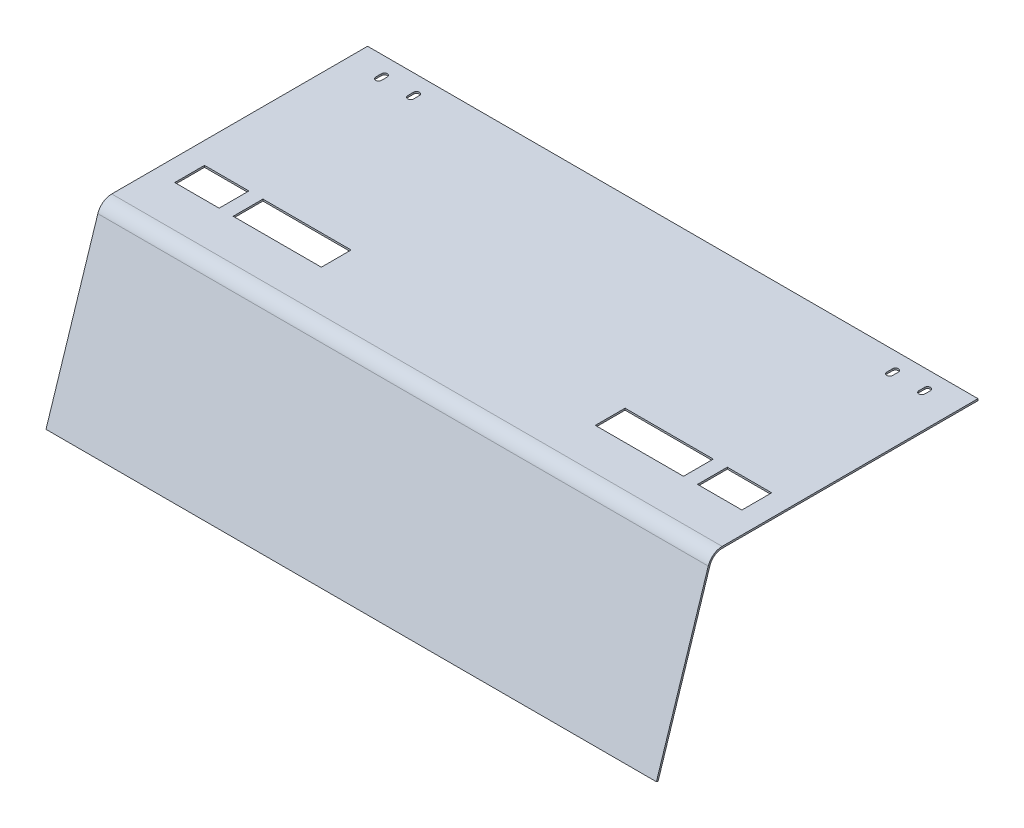
from build123d import *

# Parameters (mm, degrees)
SKETCH_1_W           = 418
SKETCH_1_H           = 175.21
EXTRUDE_1_DEPTH      = 1.2
EXTRUDE_2_DEPTH      = 209
EXTRUDE_2_DEPTH_BACK = 209
SKETCH_3_R           = 2
CUT_EXTRUDE_1_DEPTH  = 1.2
CUT_EXTRUDE_2_REACH  = 281.994
SKETCH_4_R           = 3
CUT_EXTRUDE_3_REACH  = 276.225
SKETCH_7_W           = 30.4
SKETCH_7_H           = 20.4
SKETCH_7_W_2         = 60.4


with BuildPart() as part:
    # 스케치1 → 보스-돌출1 (new body)
    with BuildSketch(Plane(origin=(0, 0, 0), x_dir=(1, 0, 0), z_dir=(0, 1, 0))):
        with Locations((0, -0.5)):
            Rectangle(SKETCH_1_W, SKETCH_1_H)
    extrude(amount=EXTRUDE_1_DEPTH)

    # 스케치2 → 보스-돌출2 (add, two sides: drawn at the far end of the back side and taken through both)
    with BuildSketch(Plane(origin=(0, 0, 0), x_dir=(0, 0, -1), z_dir=(1, 0, 0)).offset(-EXTRUDE_2_DEPTH_BACK)):
        with BuildLine():
            Line((-97.623087474, -5.733077953), (-133.119643249, -115.895422372))
            Line((-133.119643249, -115.895422372), (-131.977472753, -116.263453018))
            Line((-131.977472753, -116.263453018), (-96.480916977, -6.101108598))
            ThreePointArc((-96.480916977, -6.101108598), (-93.286204284, -1.686975175), (-88.105, 0))
            Line((-88.105, 0), (-88.105, 1.2))
            ThreePointArc((-88.105, 1.2), (-93.992732141, -0.717017244), (-97.623087474, -5.733077953))
        make_face()
    extrude(amount=EXTRUDE_2_DEPTH + EXTRUDE_2_DEPTH_BACK)

    # 스케치3 → 컷-돌출1 (cut)
    with BuildSketch(Plane(origin=(0, 1.2, 0), x_dir=(1, 0, 0), z_dir=(0, 1, 0))):
        with Locations((-186, 71.605)):
            Circle(SKETCH_3_R)
        with Locations((-186, 73.605)):
            Circle(SKETCH_3_R)
        with Locations((-186, 75.605)):
            Circle(SKETCH_3_R)
        with BuildLine():
            ThreePointArc((-187.732050808, 74.605), (-187.931851653, 75.08736191), (-188, 75.605))
            Line((-188, 75.605), (-188, 73.605))
            ThreePointArc((-188, 73.605), (-187.931851653, 74.12263809), (-187.732050808, 74.605))
        make_face()
        with BuildLine():
            ThreePointArc((-187.732050808, 72.605), (-187.931851653, 73.08736191), (-188, 73.605))
            Line((-188, 73.605), (-188, 71.605))
            ThreePointArc((-188, 71.605), (-187.931851653, 72.12263809), (-187.732050808, 72.605))
        make_face()
        with BuildLine():
            Line((-184, 71.605), (-184, 73.605))
            ThreePointArc((-184, 73.605), (-184.068148347, 73.08736191), (-184.267949192, 72.605))
            ThreePointArc((-184.267949192, 72.605), (-184.068148347, 72.12263809), (-184, 71.605))
        make_face()
        with BuildLine():
            Line((-184, 73.605), (-184, 75.605))
            ThreePointArc((-184, 75.605), (-184.068148347, 75.08736191), (-184.267949192, 74.605))
            ThreePointArc((-184.267949192, 74.605), (-184.068148347, 74.12263809), (-184, 73.605))
        make_face()
        with Locations((-164, 73.605)):
            Circle(SKETCH_3_R)
        with Locations((-164, 75.605)):
            Circle(SKETCH_3_R)
        with Locations((-164, 71.605)):
            Circle(SKETCH_3_R)
        with BuildLine():
            ThreePointArc((-165.732050808, 72.605), (-165.931851653, 73.08736191), (-166, 73.605))
            Line((-166, 73.605), (-166, 71.605))
            ThreePointArc((-166, 71.605), (-165.931851653, 72.12263809), (-165.732050808, 72.605))
        make_face()
        with BuildLine():
            ThreePointArc((-165.732050808, 74.605), (-165.931851653, 75.08736191), (-166, 75.605))
            Line((-166, 75.605), (-166, 73.605))
            ThreePointArc((-166, 73.605), (-165.931851653, 74.12263809), (-165.732050808, 74.605))
        make_face()
        with BuildLine():
            Line((-162, 71.605), (-162, 73.605))
            ThreePointArc((-162, 73.605), (-162.068148347, 73.08736191), (-162.267949192, 72.605))
            ThreePointArc((-162.267949192, 72.605), (-162.068148347, 72.12263809), (-162, 71.605))
        make_face()
        with BuildLine():
            Line((-162, 73.605), (-162, 75.605))
            ThreePointArc((-162, 75.605), (-162.068148347, 75.08736191), (-162.267949192, 74.605))
            ThreePointArc((-162.267949192, 74.605), (-162.068148347, 74.12263809), (-162, 73.605))
        make_face()
        with Locations((164, 73.605)):
            Circle(SKETCH_3_R)
        with Locations((164, 71.605)):
            Circle(SKETCH_3_R)
        with Locations((164, 75.605)):
            Circle(SKETCH_3_R)
        with BuildLine():
            ThreePointArc((162.267949192, 74.605), (162.068148347, 75.08736191), (162, 75.605))
            Line((162, 75.605), (162, 73.605))
            ThreePointArc((162, 73.605), (162.068148347, 74.12263809), (162.267949192, 74.605))
        make_face()
        with BuildLine():
            ThreePointArc((162.267949192, 72.605), (162.068148347, 73.08736191), (162, 73.605))
            Line((162, 73.605), (162, 71.605))
            ThreePointArc((162, 71.605), (162.068148347, 72.12263809), (162.267949192, 72.605))
        make_face()
        with BuildLine():
            Line((166, 73.605), (166, 75.605))
            ThreePointArc((166, 75.605), (165.931851653, 75.08736191), (165.732050808, 74.605))
            ThreePointArc((165.732050808, 74.605), (165.931851653, 74.12263809), (166, 73.605))
        make_face()
        with BuildLine():
            Line((166, 71.605), (166, 73.605))
            ThreePointArc((166, 73.605), (165.931851653, 73.08736191), (165.732050808, 72.605))
            ThreePointArc((165.732050808, 72.605), (165.931851653, 72.12263809), (166, 71.605))
        make_face()
        with Locations((186, 71.605)):
            Circle(SKETCH_3_R)
        with Locations((186, 73.605)):
            Circle(SKETCH_3_R)
        with Locations((186, 75.605)):
            Circle(SKETCH_3_R)
        with BuildLine():
            ThreePointArc((184.267949192, 74.605), (184.068148347, 75.08736191), (184, 75.605))
            Line((184, 75.605), (184, 73.605))
            ThreePointArc((184, 73.605), (184.068148347, 74.12263809), (184.267949192, 74.605))
        make_face()
        with BuildLine():
            ThreePointArc((184.267949192, 72.605), (184.068148347, 73.08736191), (184, 73.605))
            Line((184, 73.605), (184, 71.605))
            ThreePointArc((184, 71.605), (184.068148347, 72.12263809), (184.267949192, 72.605))
        make_face()
        with BuildLine():
            Line((188, 73.605), (188, 75.605))
            ThreePointArc((188, 75.605), (187.931851653, 75.08736191), (187.732050808, 74.605))
            ThreePointArc((187.732050808, 74.605), (187.931851653, 74.12263809), (188, 73.605))
        make_face()
        with BuildLine():
            Line((188, 71.605), (188, 73.605))
            ThreePointArc((188, 73.605), (187.931851653, 73.08736191), (187.732050808, 72.605))
            ThreePointArc((187.732050808, 72.605), (187.931851653, 72.12263809), (188, 71.605))
        make_face()
    extrude(amount=-CUT_EXTRUDE_1_DEPTH, mode=Mode.SUBTRACT)

    # 컷-돌출2: up to this plane
    cut_extrude_2_end = Plane(origin=(0, 0, 0), z_dir=(0, -1, 0))
    # 스케치4 → 컷-돌출2 (cut, up to the surface)
    with BuildSketch(Plane(origin=(0, 17.417324386, 3.331984817), x_dir=(1, 0, 0), z_dir=(0, 0.9821890034564742, 0.18789561327816653)), mode=Mode.PRIVATE) as cut_extrude_2_sk1:
        with Locations(Location((-179, -48.460287414, 0), (0, 0, 270))):
            Circle(SKETCH_4_R)
    cut_extrude_2_tool1 = split(extrude(cut_extrude_2_sk1.sketch, amount=-CUT_EXTRUDE_2_REACH, mode=Mode.PRIVATE), bisect_by=cut_extrude_2_end, keep=Keep.BOTH, mode=Mode.PRIVATE)
    add(cut_extrude_2_tool1.solids().sort_by_distance((-179, 8.311849, 50.929146))[0], mode=Mode.SUBTRACT)
    # 스케치4 → 컷-돌출2 (cut, up to the surface)
    with BuildSketch(Plane(origin=(0, 17.417324386, 3.331984817), x_dir=(1, 0, 0), z_dir=(0, 0.9821890034564742, 0.18789561327816653)), mode=Mode.PRIVATE) as cut_extrude_2_sk2:
        with Locations(Location((-124, -48.460287414, 0), (0, 0, 270))):
            Circle(SKETCH_4_R)
    cut_extrude_2_tool2 = split(extrude(cut_extrude_2_sk2.sketch, amount=-CUT_EXTRUDE_2_REACH, mode=Mode.PRIVATE), bisect_by=cut_extrude_2_end, keep=Keep.BOTH, mode=Mode.PRIVATE)
    add(cut_extrude_2_tool2.solids().sort_by_distance((-124, 8.311849, 50.929146))[0], mode=Mode.SUBTRACT)
    # 스케치4 → 컷-돌출2 (cut, up to the surface)
    with BuildSketch(Plane(origin=(0, 17.417324386, 3.331984817), x_dir=(1, 0, 0), z_dir=(0, 0.9821890034564742, 0.18789561327816653)), mode=Mode.PRIVATE) as cut_extrude_2_sk3:
        with Locations(Location((124, -48.460287414, 0), (0, 0, 270))):
            Circle(SKETCH_4_R)
    cut_extrude_2_tool3 = split(extrude(cut_extrude_2_sk3.sketch, amount=-CUT_EXTRUDE_2_REACH, mode=Mode.PRIVATE), bisect_by=cut_extrude_2_end, keep=Keep.BOTH, mode=Mode.PRIVATE)
    add(cut_extrude_2_tool3.solids().sort_by_distance((124, 8.311849, 50.929146))[0], mode=Mode.SUBTRACT)
    # 스케치4 → 컷-돌출2 (cut, up to the surface)
    with BuildSketch(Plane(origin=(0, 17.417324386, 3.331984817), x_dir=(1, 0, 0), z_dir=(0, 0.9821890034564742, 0.18789561327816653)), mode=Mode.PRIVATE) as cut_extrude_2_sk4:
        with Locations(Location((179, -48.460287414, 0), (0, 0, 270))):
            Circle(SKETCH_4_R)
    cut_extrude_2_tool4 = split(extrude(cut_extrude_2_sk4.sketch, amount=-CUT_EXTRUDE_2_REACH, mode=Mode.PRIVATE), bisect_by=cut_extrude_2_end, keep=Keep.BOTH, mode=Mode.PRIVATE)
    add(cut_extrude_2_tool4.solids().sort_by_distance((179, 8.311849, 50.929146))[0], mode=Mode.SUBTRACT)

    # 스케치7 → 컷-돌출3 (cut, up to next)
    with BuildSketch(Plane(origin=(0, 1.2, 0), x_dir=(1, 0, 0), z_dir=(0, 1, 0)), mode=Mode.PRIVATE) as cut_extrude_3_sk1:
        with Locations((-179, -49.568628826)):
            Rectangle(SKETCH_7_W, SKETCH_7_H)
    cut_extrude_3_tool1 = extrude(cut_extrude_3_sk1.sketch, amount=-CUT_EXTRUDE_3_REACH, mode=Mode.PRIVATE) & part.part
    # 스케치7 → 컷-돌출3 (cut, up to next)
    with BuildSketch(Plane(origin=(0, 1.2, 0), x_dir=(1, 0, 0), z_dir=(0, 1, 0)), mode=Mode.PRIVATE) as cut_extrude_3_sk2:
        with Locations((-124, -49.568628826)):
            Rectangle(SKETCH_7_W_2, SKETCH_7_H)
    cut_extrude_3_tool2 = extrude(cut_extrude_3_sk2.sketch, amount=-CUT_EXTRUDE_3_REACH, mode=Mode.PRIVATE) & part.part
    # 스케치7 → 컷-돌출3 (cut, up to next)
    with BuildSketch(Plane(origin=(0, 1.2, 0), x_dir=(1, 0, 0), z_dir=(0, 1, 0)), mode=Mode.PRIVATE) as cut_extrude_3_sk3:
        with Locations((179, -49.568628826)):
            Rectangle(SKETCH_7_W, SKETCH_7_H)
    cut_extrude_3_tool3 = extrude(cut_extrude_3_sk3.sketch, amount=-CUT_EXTRUDE_3_REACH, mode=Mode.PRIVATE) & part.part
    # 스케치7 → 컷-돌출3 (cut, up to next)
    with BuildSketch(Plane(origin=(0, 1.2, 0), x_dir=(1, 0, 0), z_dir=(0, 1, 0)), mode=Mode.PRIVATE) as cut_extrude_3_sk4:
        with Locations((124, -49.568628826)):
            Rectangle(SKETCH_7_W_2, SKETCH_7_H)
    cut_extrude_3_tool4 = extrude(cut_extrude_3_sk4.sketch, amount=-CUT_EXTRUDE_3_REACH, mode=Mode.PRIVATE) & part.part
    add(cut_extrude_3_tool1.solids().sort_by_distance((-179, 1.2, 49.568629))[0], mode=Mode.SUBTRACT)
    add(cut_extrude_3_tool2.solids().sort_by_distance((-124, 1.2, 49.568629))[0], mode=Mode.SUBTRACT)
    add(cut_extrude_3_tool3.solids().sort_by_distance((179, 1.2, 49.568629))[0], mode=Mode.SUBTRACT)
    add(cut_extrude_3_tool4.solids().sort_by_distance((124, 1.2, 49.568629))[0], mode=Mode.SUBTRACT)


solid = part.part
